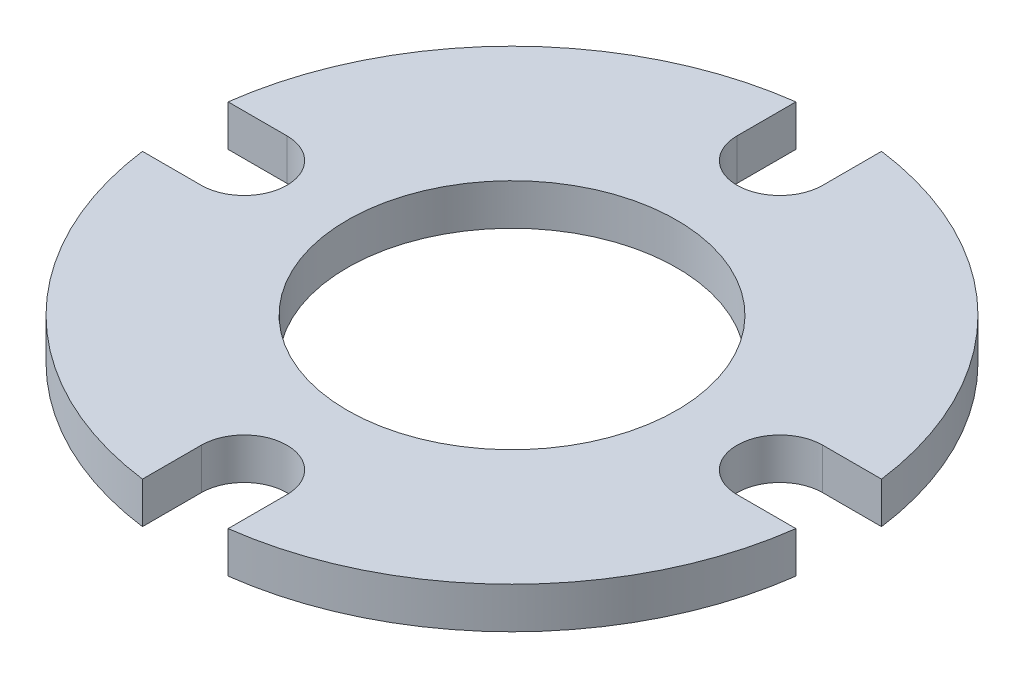
from build123d import *

# Parameters (mm, degrees)
SKETCH1_R           = 0.5
BOSS_EXTRUDE1_DEPTH = 0.0625


with BuildPart() as part:
    # Sketch1 → Boss-Extrude1 (new, symmetric)
    with BuildSketch(Plane(origin=(0, 0, 0), x_dir=(1, 0, 0), z_dir=(0, 1, 0))):
        with BuildLine():
            Line((0.813, 0.13), (0.991513994, 0.13))
            ThreePointArc((0.991513994, 0.13), (0.707106781, 0.707106781), (0.13, 0.991513994))
            Line((0.13, 0.991513994), (0.13, 0.813))
            ThreePointArc((0.13, 0.813), (0, 0.683), (-0.13, 0.813))
            Line((-0.13, 0.813), (-0.13, 0.991513994))
            ThreePointArc((-0.13, 0.991513994), (-0.707106781, 0.707106781), (-0.991513994, 0.13))
            Line((-0.991513994, 0.13), (-0.813, 0.13))
            ThreePointArc((-0.813, 0.13), (-0.683, 0), (-0.813, -0.13))
            Line((-0.813, -0.13), (-0.991513994, -0.13))
            ThreePointArc((-0.991513994, -0.13), (-0.707106781, -0.707106781), (-0.13, -0.991513994))
            Line((-0.13, -0.991513994), (-0.13, -0.813))
            ThreePointArc((-0.13, -0.813), (0, -0.683), (0.13, -0.813))
            Line((0.13, -0.813), (0.13, -0.991513994))
            ThreePointArc((0.13, -0.991513994), (0.707106781, -0.707106781), (0.991513994, -0.13))
            Line((0.991513994, -0.13), (0.813, -0.13))
            ThreePointArc((0.813, -0.13), (0.683, 0), (0.813, 0.13))
        make_face()
        with Locations(Location((0, 0, 0), (0, 0, 270))):
            Circle(SKETCH1_R, mode=Mode.SUBTRACT)
    extrude(amount=BOSS_EXTRUDE1_DEPTH, both=True)


solid = part.part
